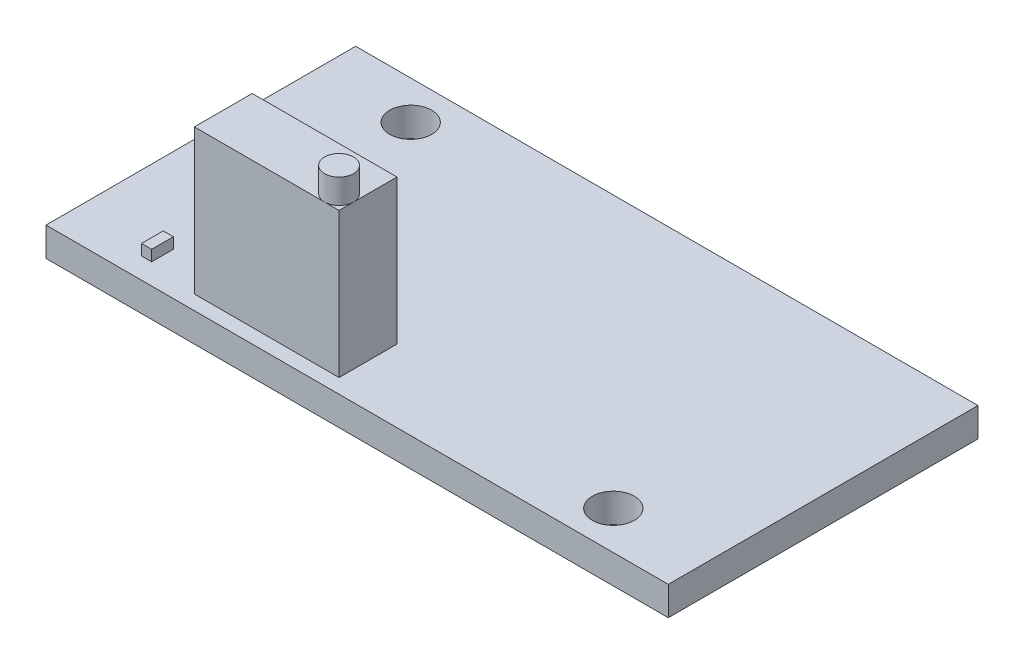
from build123d import *

# Parameters (mm, degrees)
SKETCH1_W           = 43
SKETCH1_H           = 21.4
BOSS_EXTRUDE1_DEPTH = 2
SKETCH2_R           = 1.45
CUT_EXTRUDE1_DEPTH  = 25.098547674
SKETCH3_W           = 10
SKETCH3_H           = 4
BOSS_EXTRUDE2_DEPTH = 10
SKETCH4_R           = 1
BOSS_EXTRUDE3_DEPTH = 1.7
SKETCH5_W           = 0.7
SKETCH5_H           = 1.5
BOSS_EXTRUDE4_DEPTH = 0.75


with BuildPart() as part:
    # Sketch1 → Boss-Extrude1 (new body)
    with BuildSketch(Plane(origin=(0, 0, 0), x_dir=(1, 0, 0), z_dir=(0, 1, 0))):
        Rectangle(SKETCH1_W, SKETCH1_H)
    extrude(amount=BOSS_EXTRUDE1_DEPTH)

    # Sketch2 → Cut-Extrude1 (cut, through all)
    with BuildSketch(Plane(origin=(0, 2, 0), x_dir=(1, 0, 0), z_dir=(0, 1, 0))):
        with Locations(Location((-15.05, 8.05, 0), (0, 0, 270))):
            Circle(SKETCH2_R)
        with Locations(Location((15.05, -8.05, 0), (0, 0, 270))):
            Circle(SKETCH2_R)
    extrude(amount=-CUT_EXTRUDE1_DEPTH, mode=Mode.SUBTRACT)

    # Sketch3 → Boss-Extrude2 (add)
    with BuildSketch(Plane(origin=(0, 2, 0), x_dir=(1, 0, 0), z_dir=(0, 1, 0))):
        with Locations((-7.25, -7.7)):
            Rectangle(SKETCH3_W, SKETCH3_H)
    extrude(amount=BOSS_EXTRUDE2_DEPTH)

    # Sketch4 → Boss-Extrude3 (add)
    with BuildSketch(Plane(origin=(0, 12, 0), x_dir=(1, 0, 0), z_dir=(0, 1, 0))):
        with Locations(Location((-3.25, -8.7, 0), (0, 0, 270))):
            Circle(SKETCH4_R)
    extrude(amount=BOSS_EXTRUDE3_DEPTH)

    # Sketch5 → Boss-Extrude4 (add)
    with BuildSketch(Plane(origin=(0, 2, 0), x_dir=(1, 0, 0), z_dir=(0, 1, 0))):
        with Locations((-16, -8.5)):
            Rectangle(SKETCH5_W, SKETCH5_H)
    extrude(amount=BOSS_EXTRUDE4_DEPTH)


solid = part.part
